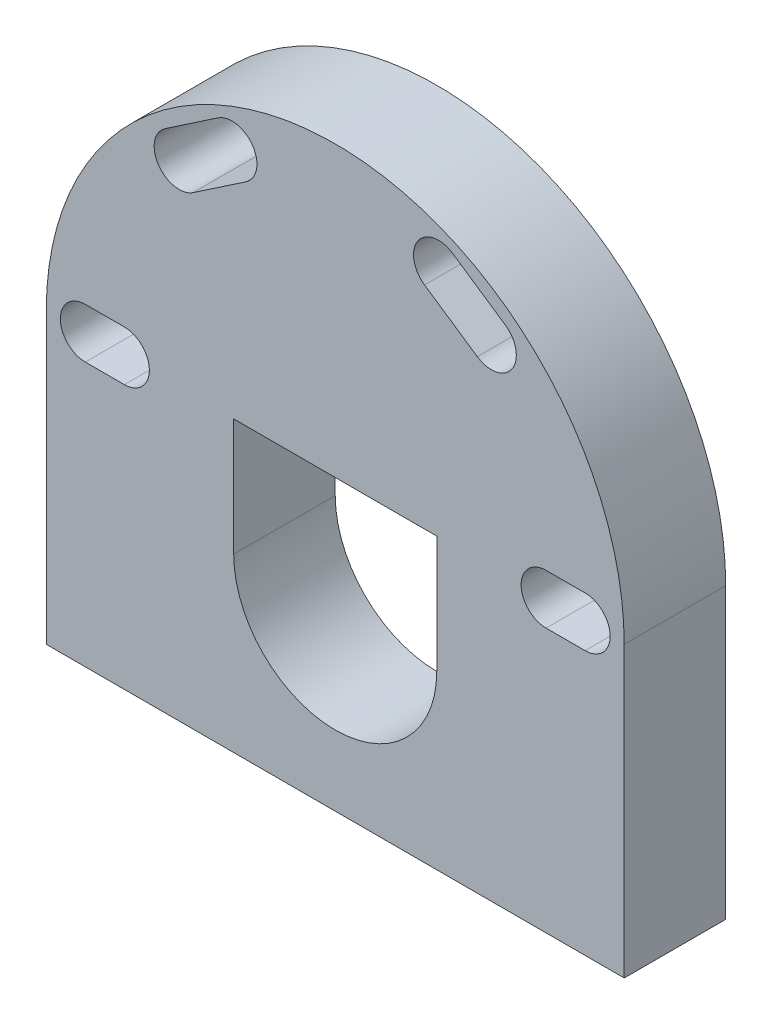
from build123d import *

# Parameters (mm, degrees)
IZIM1_R                          = 18.5
Y_KSEKLIK_EKSTR_ZYON1_DEPTH      = 6.5
KES_EKSTR_ZYON1_DEPTH            = 6.5
Y_KSEKLIK_EKSTR_ZYON2_DEPTH      = 6.5
Y_KSEKLIK_EKSTR_ZYON3_DEPTH      = 30
Y_KSEKLIK_EKSTR_ZYON3_DEPTH_BACK = 6.5
IZIM4_W                          = 37
IZIM4_H                          = 4
IZIM5_W                          = 36.995441418
IZIM5_H                          = 250
Y_KSEKLIK_EKSTR_ZYON4_DEPTH      = 4
Y_KSEKLIK_EKSTR_ZYON6_DEPTH      = 6.5
Y_KSEKLIK_EKSTR_ZYON7_DEPTH      = 4
Y_KSEKLIK_EKSTR_ZYON8_DEPTH      = 6
IZIM15_W                         = 170.62151123
IZIM15_H                         = 260.400815818
KES_EKSTR_ZYON2_DEPTH            = 75.752098375
KES_EKSTR_ZYON3_DEPTH            = 8
IZIM17_W                         = 85.533609072
IZIM17_H                         = 320.477083545
KES_EKSTR_ZYON4_DEPTH            = 8
KES_EKSTR_ZYON5_DEPTH            = 8


with BuildPart() as part:
    # Çizim1 → Yükseklik-Ekstrüzyon1 (new body)
    with BuildSketch(Plane.XY):
        with Locations(Location((0, 0, 0), (0, 0, 180))):
            Circle(IZIM1_R)
    extrude(amount=Y_KSEKLIK_EKSTR_ZYON1_DEPTH)

    # Çizim2 → Kes-Ekstrüzyon1 (cut)
    with BuildSketch(Plane.XY.offset(6.5)):
        with BuildLine():
            Line((6.5, 0), (6.5, -7.5))
            ThreePointArc((6.5, -7.5), (0, -14), (-6.5, -7.5))
            Line((-6.5, -7.5), (-6.5, 0))
            Line((-6.5, 0), (6.5, 0))
        make_face()
        with BuildLine():
            Line((-16, 1.6), (-13.5, 1.6))
            ThreePointArc((-13.5, 1.6), (-11.9, 0), (-13.5, -1.6))
            Line((-13.5, -1.6), (-16, -1.6))
            ThreePointArc((-16, -1.6), (-17.6, 0), (-16, 1.6))
        make_face()
        with BuildLine():
            Line((16, -1.6), (13.5, -1.6))
            ThreePointArc((13.5, -1.6), (11.9, 0), (13.5, 1.6))
            Line((13.5, 1.6), (16, 1.6))
            ThreePointArc((16, 1.6), (17.6, 0), (16, -1.6))
        make_face()
        with BuildLine():
            Line((7.510154292, 16.186602557), (10.890511962, 13.897826987))
            ThreePointArc((10.890511962, 13.897826987), (11.31834042, 11.675899263), (9.096412696, 11.248070806))
            Line((9.096412696, 11.248070806), (5.716055026, 13.536846375))
            ThreePointArc((5.716055026, 13.536846375), (5.288226568, 15.758774099), (7.510154292, 16.186602557))
        make_face()
        with BuildLine():
            Line((-7.510154292, 16.186602557), (-10.890511962, 13.897826987))
            ThreePointArc((-10.890511962, 13.897826987), (-11.31834042, 11.675899263), (-9.096412696, 11.248070806))
            Line((-9.096412696, 11.248070806), (-5.716055026, 13.536846375))
            ThreePointArc((-5.716055026, 13.536846375), (-5.288226568, 15.758774099), (-7.510154292, 16.186602557))
        make_face()
    extrude(amount=-KES_EKSTR_ZYON1_DEPTH, mode=Mode.SUBTRACT)

    # Çizim3 → Yükseklik-Ekstrüzyon2 (add)
    with BuildSketch(Plane(origin=(0, 0, 0), x_dir=(-1, 0, 0), z_dir=(0, 0, -1))):
        with BuildLine():
            ThreePointArc((0, -18.5), (-13.081475452, -13.081475452), (-18.5, 0))
            Line((-18.5, 0), (-18.5, -18.5))
            Line((-18.5, -18.5), (0, -18.5))
        make_face()
        with BuildLine():
            Line((18.5, -18.5), (18.5, 0))
            ThreePointArc((18.5, 0), (13.081475452, -13.081475452), (0, -18.5))
            Line((0, -18.5), (18.5, -18.5))
        make_face()
    extrude(amount=-Y_KSEKLIK_EKSTR_ZYON2_DEPTH)

    # Çizim4 → Yükseklik-Ekstrüzyon3 (add, two sides: drawn at the far end of the back side and taken through both)
    with BuildSketch(Plane.XY.offset(6.5).offset(-Y_KSEKLIK_EKSTR_ZYON3_DEPTH_BACK)):
        with Locations((0, -20.5)):
            Rectangle(IZIM4_W, IZIM4_H)
    extrude(amount=Y_KSEKLIK_EKSTR_ZYON3_DEPTH + Y_KSEKLIK_EKSTR_ZYON3_DEPTH_BACK)

    # Çizim5 → Yükseklik-Ekstrüzyon4 (add)
    with BuildSketch(Plane.XZ.offset(22.5)):
        with Locations((-0.002279291, 125)):
            Rectangle(IZIM5_W, IZIM5_H)
    extrude(amount=-Y_KSEKLIK_EKSTR_ZYON4_DEPTH)

    # Çizim10 → Yükseklik-Ekstrüzyon6 (add)
    with BuildSketch(Plane.XY.offset(250)):
        with BuildLine():
            Line((-18.5, 0), (-18.5, -18.5))
            Line((-18.5, -18.5), (18.5, -18.5))
            Line((18.5, -18.5), (18.5, 0))
            ThreePointArc((18.5, 0), (0, 18.5), (-18.5, 0))
        make_face()
        with BuildLine():
            Line((5.716055026, 13.536846375), (9.096412696, 11.248070806))
            ThreePointArc((9.096412696, 11.248070806), (11.31834042, 11.675899263), (10.890511962, 13.897826987))
            Line((10.890511962, 13.897826987), (7.510154292, 16.186602557))
            ThreePointArc((7.510154292, 16.186602557), (5.288226568, 15.758774099), (5.716055026, 13.536846375))
        make_face(mode=Mode.SUBTRACT)
        with BuildLine():
            Line((-7.510154292, 16.186602557), (-10.890511962, 13.897826987))
            ThreePointArc((-10.890511962, 13.897826987), (-11.31834042, 11.675899263), (-9.096412696, 11.248070806))
            Line((-9.096412696, 11.248070806), (-5.716055026, 13.536846375))
            ThreePointArc((-5.716055026, 13.536846375), (-5.288226568, 15.758774099), (-7.510154292, 16.186602557))
        make_face(mode=Mode.SUBTRACT)
        with BuildLine():
            Line((-13.5, 1.6), (-16, 1.6))
            ThreePointArc((-16, 1.6), (-17.6, 0), (-16, -1.6))
            Line((-16, -1.6), (-13.5, -1.6))
            ThreePointArc((-13.5, -1.6), (-11.9, 0), (-13.5, 1.6))
        make_face(mode=Mode.SUBTRACT)
        with BuildLine():
            Line((6.5, -7.5), (6.5, 0))
            Line((6.5, 0), (-6.5, 0))
            Line((-6.5, 0), (-6.5, -7.5))
            ThreePointArc((-6.5, -7.5), (0, -14), (6.5, -7.5))
        make_face(mode=Mode.SUBTRACT)
        with BuildLine():
            Line((13.5, -1.6), (16, -1.6))
            ThreePointArc((16, -1.6), (17.6, 0), (16, 1.6))
            Line((16, 1.6), (13.5, 1.6))
            ThreePointArc((13.5, 1.6), (11.9, 0), (13.5, -1.6))
        make_face(mode=Mode.SUBTRACT)
    extrude(amount=-Y_KSEKLIK_EKSTR_ZYON6_DEPTH)

    # Çizim12 → Yükseklik-Ekstrüzyon7 (add)
    with BuildSketch(Plane(origin=(0, -18.5, 0), x_dir=(1, 0, 0), z_dir=(0, 1, 0))):
        with BuildLine():
            Line((-18.5, 0), (-18.5, -250))
            ThreePointArc((-18.5, -250), (-136.505823788, -125), (-18.5, 0))
        make_face()
    extrude(amount=-Y_KSEKLIK_EKSTR_ZYON7_DEPTH)

    # Çizim14 → Yükseklik-Ekstrüzyon8 (add)
    with BuildSketch(Plane.XZ.offset(22.5)):
        with BuildLine():
            Line((18.5, 36.5), (18.495441418, 36.5))
            Line((18.495441418, 36.5), (18.495441418, 250))
            Line((18.495441418, 250), (-18.5, 250))
            ThreePointArc((-18.5, 250), (-136.505823788, 125), (-18.5, 0))
            Line((-18.5, 0), (18.5, 0))
            Line((18.5, 0), (18.5, 36.5))
        make_face()
    extrude(amount=Y_KSEKLIK_EKSTR_ZYON8_DEPTH)

    # Çizim15 → Kes-Ekstrüzyon2 (cut)
    with BuildSketch(Plane(origin=(0, -18.5, 0), x_dir=(1, 0, 0), z_dir=(0, 1, 0))):
        with Locations((-103.810755615, -130.200407909)):
            Rectangle(IZIM15_W, IZIM15_H)
    extrude(amount=-KES_EKSTR_ZYON2_DEPTH, mode=Mode.SUBTRACT)

    # Çizim16 → Kes-Ekstrüzyon3 (cut)
    with BuildSketch(Plane.XZ.offset(28.5)):
        Polygon((-18.5, 250), (-18.5, 0), (18.5, 0), (18.5, 36.5), (18.495441418, 36.5), (18.495441418, 250), align=None)
    extrude(amount=-KES_EKSTR_ZYON3_DEPTH, mode=Mode.SUBTRACT)

    # Çizim17 → Kes-Ekstrüzyon4 (cut)
    with BuildSketch(Plane(origin=(0, -18.5, 0), x_dir=(1, 0, 0), z_dir=(0, 1, 0))):
        with Locations((24.266804536, -83.261458228)):
            Rectangle(IZIM17_W, IZIM17_H)
    extrude(amount=-KES_EKSTR_ZYON4_DEPTH, mode=Mode.SUBTRACT)


with BuildPart() as kes_ekstr_zyon4_piece_1:
    # of the separate pieces the step leaves, piece 1, a body of its own (kes_ekstr_zyon4_pieces)
    add(part.part.solids().sort_by_distance((-18.5, 0, 243.5))[0])

    # Çizim18 → Kes-Ekstrüzyon5 (cut)
    with BuildSketch(Plane(origin=(0, 0, 243.5), x_dir=(-1, 0, 0), z_dir=(0, 0, -1))):
        with BuildLine():
            Line((-18.5, 0), (-18.5, -18.5))
            Line((-18.5, -18.5), (-18.495441418, -18.5))
            Line((-18.495441418, -18.5), (-18.495441418, -20.5))
            Line((-18.495441418, -20.5), (18.5, -20.5))
            Line((18.5, -20.5), (18.5, 0))
            ThreePointArc((18.5, 0), (0, 18.5), (-18.5, 0))
        make_face()
    extrude(amount=-KES_EKSTR_ZYON5_DEPTH, mode=Mode.SUBTRACT)


with BuildPart() as kes_ekstr_zyon4_piece_2:
    # of the separate pieces the step leaves, piece 2, a body of its own (kes_ekstr_zyon4_pieces)
    add(part.part.solids().sort_by_distance((-18.5, 0, 0))[0])


solid = kes_ekstr_zyon4_piece_2.part
